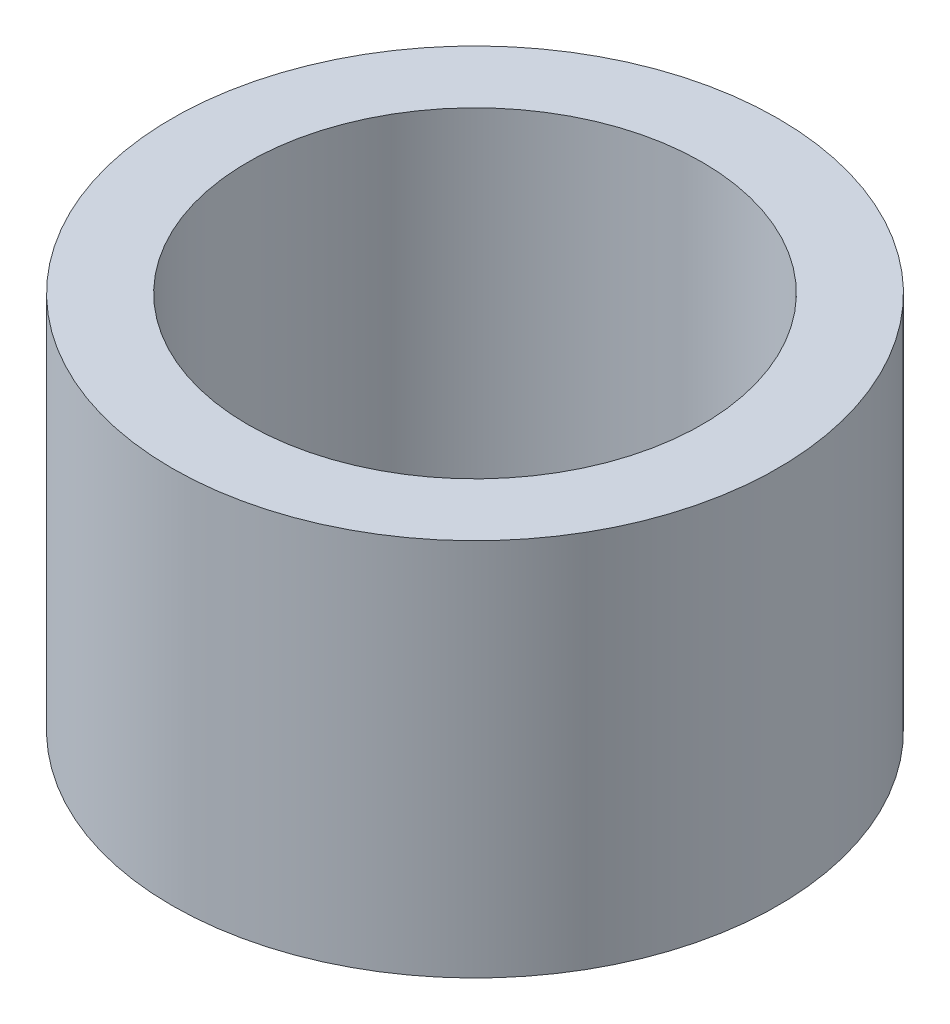
from build123d import *

# Parameters (mm, degrees)
SKETCH_1_R      = 4
SKETCH_1_R_2    = 3
EXTRUDE_1_DEPTH = 5


with BuildPart() as part:
    # Эскиз1 → Бобышка-Вытянуть1 (new body)
    with BuildSketch(Plane(origin=(0, 0, 0), x_dir=(1, 0, 0), z_dir=(0, 1, 0))):
        with Locations(Location((0, 0, 0), (0, 0, 270))):
            Circle(SKETCH_1_R)
        with Locations(Location((0, 0, 0), (0, 0, 270))):
            Circle(SKETCH_1_R_2, mode=Mode.SUBTRACT)
    extrude(amount=EXTRUDE_1_DEPTH)


solid = part.part
